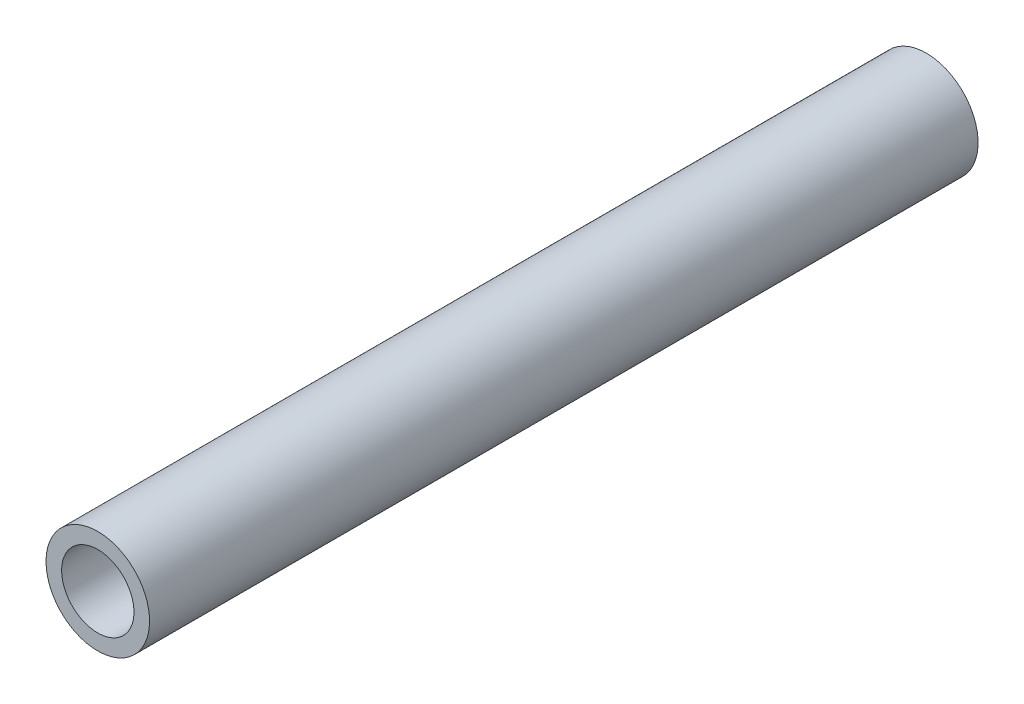
from build123d import *

# Parameters (mm, degrees)
SKETCH1_R           = 9.525
SKETCH1_R_2         = 6.6548
EXTRUDE_THIN1_DEPTH = 152.4


with BuildPart() as part:
    # Sketch1 → Extrude-Thin1 (new body)
    with BuildSketch(Plane.XY):
        Circle(SKETCH1_R)
        Circle(SKETCH1_R_2, mode=Mode.SUBTRACT)
    extrude(amount=EXTRUDE_THIN1_DEPTH)


solid = part.part
